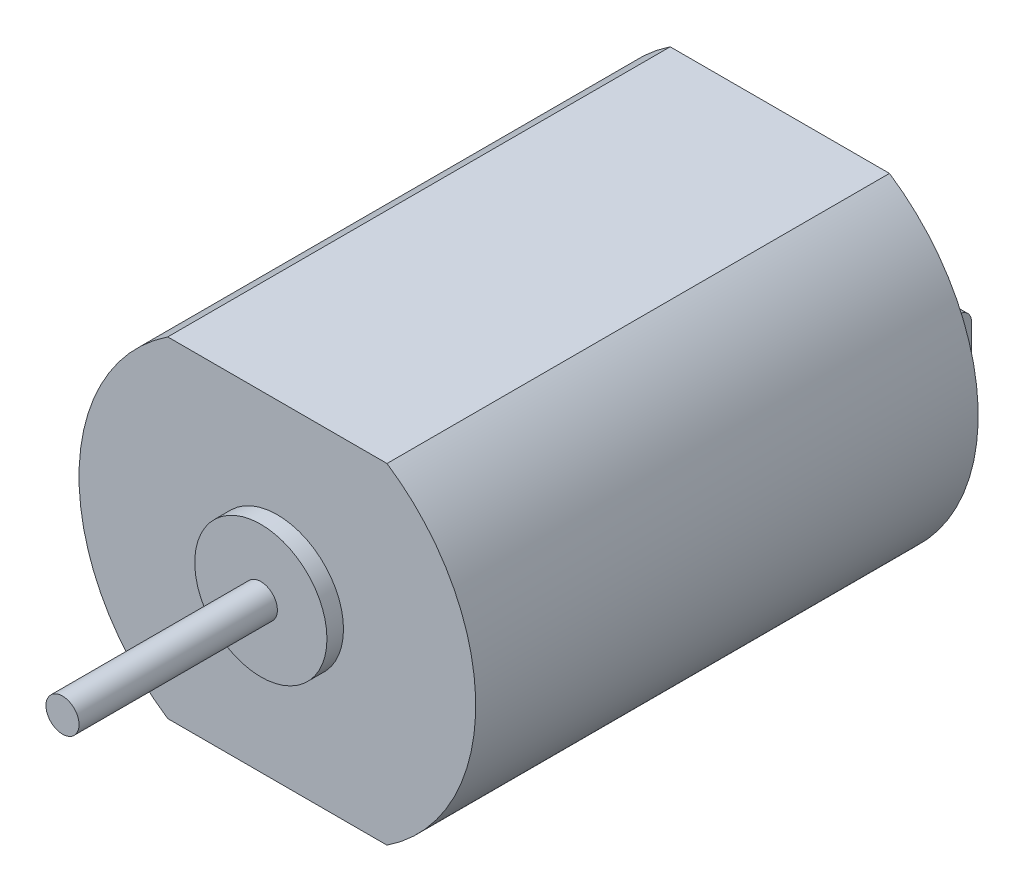
from build123d import *

# Parameters (mm, degrees)
SKETCH_1_W          = 0.3
SKETCH_1_H          = 1.5
SKETCH_1_R          = 2.5
SKETCH_1_R_2        = 1.5
EXTRUDE_1_DEPTH     = 15.2
SKETCH_1_4_W        = 0.3
SKETCH_1_4_H        = 1.5
EXTRUDE_2_DEPTH     = 2
CUT_EXTRUDE_2_DEPTH = 19.763794925
FILLET_1_R          = 0.4
SKETCH_1_5_R        = 2.5
SKETCH_1_5_R_2      = 1.5
EXTRUDE_3_DEPTH     = 1.2
CUT_EXTRUDE_START   = -1.2
SKETCH_1_7_R        = 1.5
CUT_EXTRUDE_1_DEPTH = 0.6
FILLET_2_R          = 0.4
SKETCH_3_R          = 2
EXTRUDE_4_DEPTH     = 0.5
SKETCH_3_3_R        = 0.5
EXTRUDE_5_DEPTH     = 6.5


with BuildPart() as part:
    # 草图1 → 凸台-拉伸1 (new body)
    # profile 1 of 5: a face of its own
    with BuildSketch(Plane.XY):
        with BuildLine():
            ThreePointArc((-6, 0), (-5.286764074, -2.837274331), (-3.31662479, -5))
            Line((-3.31662479, -5), (3.31662479, -5))
            ThreePointArc((3.31662479, -5), (5.286764074, -2.837274331), (6, 0))
            ThreePointArc((6, 0), (5.286764074, 2.837274331), (3.31662479, 5))
            Line((3.31662479, 5), (-3.31662479, 5))
            ThreePointArc((-3.31662479, 5), (-5.286764074, 2.837274331), (-6, 0))
        make_face()
        with Locations((-3.65, 0)):
            Rectangle(SKETCH_1_W, SKETCH_1_H, mode=Mode.SUBTRACT)
        Circle(SKETCH_1_R, mode=Mode.SUBTRACT)
        with Locations((3.65, 0)):
            Rectangle(SKETCH_1_W, SKETCH_1_H, mode=Mode.SUBTRACT)
    # profile 2 of 5: a face of its own
    with BuildSketch(Plane.XY):
        Circle(SKETCH_1_R)
        Circle(SKETCH_1_R_2, mode=Mode.SUBTRACT)
    # profile 3 of 5: a face of its own
    with BuildSketch(Plane.XY):
        Circle(SKETCH_1_R_2)
    # profile 4 of 5: a face of its own
    with BuildSketch(Plane.XY):
        with Locations((3.65, 0)):
            Rectangle(SKETCH_1_W, SKETCH_1_H)
    # profile 5 of 5: a face of its own
    with BuildSketch(Plane.XY):
        with Locations((-3.65, 0)):
            Rectangle(SKETCH_1_W, SKETCH_1_H)
    extrude(amount=EXTRUDE_1_DEPTH)

    # 草图1<4> → 凸台-拉伸2 (add)
    with BuildSketch(Plane.XY):
        with Locations((3.65, 0)):
            Rectangle(SKETCH_1_4_W, SKETCH_1_4_H)
        with Locations((-3.65, 0)):
            Rectangle(SKETCH_1_4_W, SKETCH_1_4_H)
    extrude(amount=-EXTRUDE_2_DEPTH)

    # 草图2 → 切除-拉伸2 (cut, through all)
    with BuildSketch(Plane(origin=(3.8, 0, 0), x_dir=(0, 0, -1), z_dir=(1, 0, 0))):
        with BuildLine():
            Line((0.95, 0.45), (1.05, 0.45))
            ThreePointArc((1.05, 0.45), (1.5, 0), (1.05, -0.45))
            Line((1.05, -0.45), (0.95, -0.45))
            ThreePointArc((0.95, -0.45), (0.5, 0), (0.95, 0.45))
        make_face()
    extrude(amount=-CUT_EXTRUDE_2_DEPTH, mode=Mode.SUBTRACT)

    # 圆角1
    fillet_1_edges = [part.edges().sort_by_distance(p)[0] for p in [
        (3.65, -0.75, -2),
        (3.65, 0.75, -2),
        (-3.65, -0.75, -2),
        (-3.65, 0.75, -2),
    ]]
    fillet(fillet_1_edges, radius=FILLET_1_R)

    # 草图1<5> → 凸台-拉伸3 (add)
    # profile 1 of 2: a face of its own
    with BuildSketch(Plane.XY):
        Circle(SKETCH_1_5_R)
        Circle(SKETCH_1_5_R_2, mode=Mode.SUBTRACT)
    # profile 2 of 2: a face of its own
    with BuildSketch(Plane.XY):
        Circle(SKETCH_1_5_R_2)
    extrude(amount=-EXTRUDE_3_DEPTH)

    # 草图1<7> → 切除-拉伸1 (cut)
    with BuildSketch(Plane.XY.offset(CUT_EXTRUDE_START)):
        Circle(SKETCH_1_7_R)
    extrude(amount=CUT_EXTRUDE_1_DEPTH, mode=Mode.SUBTRACT)

    # 圆角2
    fillet_2_edges = [part.edges().sort_by_distance(p)[0] for p in [
        (-2.5, 0, -1.2),
    ]]
    fillet(fillet_2_edges, radius=FILLET_2_R)

    # 草图3 → 凸台-拉伸4 (add)
    with BuildSketch(Plane.XY.offset(15.2)):
        Circle(SKETCH_3_R)
    extrude(amount=EXTRUDE_4_DEPTH)

    # 草图3<3> → 凸台-拉伸5 (add)
    with BuildSketch(Plane.XY.offset(15.2)):
        Circle(SKETCH_3_3_R)
    extrude(amount=EXTRUDE_5_DEPTH)


solid = part.part
